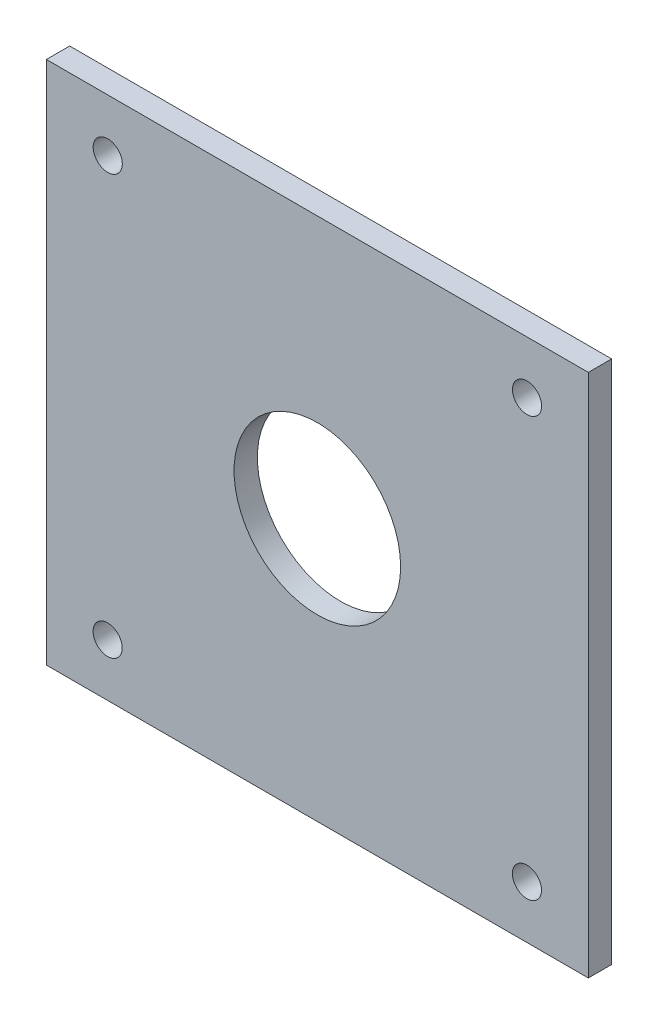
from build123d import *

# Parameters (mm, degrees)
SKETCH1_W           = 93
SKETCH1_H           = 90
SKETCH1_R           = 14.29
SKETCH1_R_2         = 2.5
BOSS_EXTRUDE1_DEPTH = 4


with BuildPart() as part:
    # Sketch1 → Boss-Extrude1 (new body)
    with BuildSketch(Plane.XY):
        Rectangle(SKETCH1_W, SKETCH1_H)
        Circle(SKETCH1_R, mode=Mode.SUBTRACT)
        with Locations((-35.981498632, -35.966614814)):
            Circle(SKETCH1_R_2, mode=Mode.SUBTRACT)
        with Locations((-35.966614814, 35.981498632)):
            Circle(SKETCH1_R_2, mode=Mode.SUBTRACT)
        with Locations((35.981498632, 35.966614814)):
            Circle(SKETCH1_R_2, mode=Mode.SUBTRACT)
        with Locations((35.966614814, -35.981498632)):
            Circle(SKETCH1_R_2, mode=Mode.SUBTRACT)
    extrude(amount=BOSS_EXTRUDE1_DEPTH)


solid = part.part
